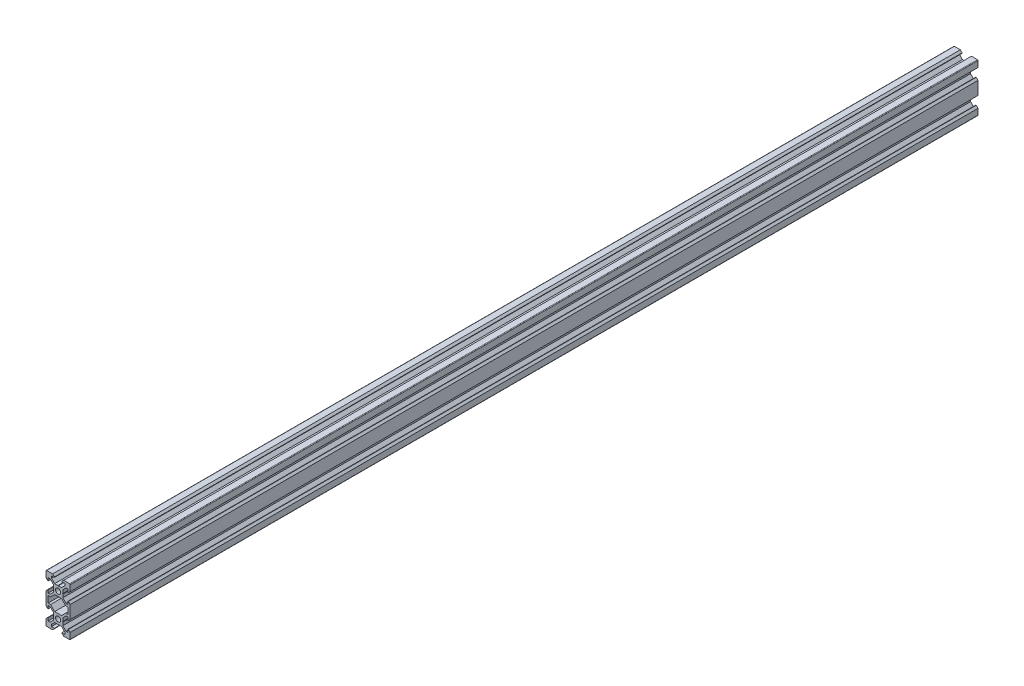
from build123d import *

# Parameters (mm, degrees)
SKETCH1_R           = 2.1
BOSS_EXTRUDE1_DEPTH = 750


with BuildPart() as part:
    # Sketch1 → Boss-Extrude1 (new body)
    with BuildSketch(Plane.XY):
        with BuildLine():
            Line((4.58, -20), (9.5, -20))
            ThreePointArc((9.5, -20), (9.853553391, -19.853553391), (10, -19.5))
            Line((10, -19.5), (10, -14.58))
            Line((10, -14.58), (8.545, -13.125))
            Line((8.545, -13.125), (8.2, -13.125))
            Line((8.2, -13.125), (8.2, -15.5))
            Line((8.2, -15.5), (6.560660172, -15.5))
            Line((6.560660172, -15.5), (3.9, -12.839339828))
            Line((3.9, -12.839339828), (3.9, -10.21))
            Line((3.9, -10.21), (3.69, -10))
            Line((3.69, -10), (3.9, -9.79))
            Line((3.9, -9.79), (3.9, -7.160660172))
            Line((3.9, -7.160660172), (6.560660172, -4.5))
            Line((6.560660172, -4.5), (8.2, -4.5))
            Line((8.2, -4.5), (8.2, -6.875))
            Line((8.2, -6.875), (8.545, -6.875))
            Line((8.545, -6.875), (10, -5.42))
            Line((10, -5.42), (10, 5.42))
            Line((10, 5.42), (8.545, 6.875))
            Line((8.545, 6.875), (8.2, 6.875))
            Line((8.2, 6.875), (8.2, 4.5))
            Line((8.2, 4.5), (6.560660172, 4.5))
            Line((6.560660172, 4.5), (3.9, 7.160660172))
            Line((3.9, 7.160660172), (3.9, 9.79))
            Line((3.9, 9.79), (3.69, 10))
            Line((3.69, 10), (3.9, 10.21))
            Line((3.9, 10.21), (3.9, 12.839339828))
            Line((3.9, 12.839339828), (6.560660172, 15.5))
            Line((6.560660172, 15.5), (8.2, 15.5))
            Line((8.2, 15.5), (8.2, 13.125))
            Line((8.2, 13.125), (8.545, 13.125))
            Line((8.545, 13.125), (10, 14.58))
            Line((10, 14.58), (10, 19.5))
            ThreePointArc((10, 19.5), (9.853553391, 19.853553391), (9.5, 20))
            Line((9.5, 20), (4.58, 20))
            Line((4.58, 20), (3.125, 18.545))
            Line((3.125, 18.545), (3.125, 18.2))
            Line((3.125, 18.2), (5.5, 18.2))
            Line((5.5, 18.2), (5.5, 16.560660172))
            Line((5.5, 16.560660172), (2.839339828, 13.9))
            Line((2.839339828, 13.9), (0.21, 13.9))
            Line((0.21, 13.9), (0, 13.69))
            Line((0, 13.69), (-0.21, 13.9))
            Line((-0.21, 13.9), (-2.839339828, 13.9))
            Line((-2.839339828, 13.9), (-5.5, 16.560660172))
            Line((-5.5, 16.560660172), (-5.5, 18.2))
            Line((-5.5, 18.2), (-3.125, 18.2))
            Line((-3.125, 18.2), (-3.125, 18.545))
            Line((-3.125, 18.545), (-4.58, 20))
            Line((-4.58, 20), (-9.5, 20))
            ThreePointArc((-9.5, 20), (-9.853553391, 19.853553391), (-10, 19.5))
            Line((-10, 19.5), (-10, 14.58))
            Line((-10, 14.58), (-8.545, 13.125))
            Line((-8.545, 13.125), (-8.2, 13.125))
            Line((-8.2, 13.125), (-8.2, 15.5))
            Line((-8.2, 15.5), (-6.560660172, 15.5))
            Line((-6.560660172, 15.5), (-3.9, 12.839339828))
            Line((-3.9, 12.839339828), (-3.9, 10.21))
            Line((-3.9, 10.21), (-3.69, 10))
            Line((-3.69, 10), (-3.9, 9.79))
            Line((-3.9, 9.79), (-3.9, 7.160660172))
            Line((-3.9, 7.160660172), (-6.560660172, 4.5))
            Line((-6.560660172, 4.5), (-8.2, 4.5))
            Line((-8.2, 4.5), (-8.2, 6.875))
            Line((-8.2, 6.875), (-8.545, 6.875))
            Line((-8.545, 6.875), (-10, 5.42))
            Line((-10, 5.42), (-10, -5.42))
            Line((-10, -5.42), (-8.545, -6.875))
            Line((-8.545, -6.875), (-8.2, -6.875))
            Line((-8.2, -6.875), (-8.2, -4.5))
            Line((-8.2, -4.5), (-6.560660172, -4.5))
            Line((-6.560660172, -4.5), (-3.9, -7.160660172))
            Line((-3.9, -7.160660172), (-3.9, -9.79))
            Line((-3.9, -9.79), (-3.69, -10))
            Line((-3.69, -10), (-3.9, -10.21))
            Line((-3.9, -10.21), (-3.9, -12.839339828))
            Line((-3.9, -12.839339828), (-6.560660172, -15.5))
            Line((-6.560660172, -15.5), (-8.2, -15.5))
            Line((-8.2, -15.5), (-8.2, -13.125))
            Line((-8.2, -13.125), (-8.545, -13.125))
            Line((-8.545, -13.125), (-10, -14.58))
            Line((-10, -14.58), (-10, -19.5))
            ThreePointArc((-10, -19.5), (-9.853553391, -19.853553391), (-9.5, -20))
            Line((-9.5, -20), (-4.58, -20))
            Line((-4.58, -20), (-3.125, -18.545))
            Line((-3.125, -18.545), (-3.125, -18.2))
            Line((-3.125, -18.2), (-5.5, -18.2))
            Line((-5.5, -18.2), (-5.5, -16.560660172))
            Line((-5.5, -16.560660172), (-2.839339828, -13.9))
            Line((-2.839339828, -13.9), (-0.21, -13.9))
            Line((-0.21, -13.9), (0, -13.69))
            Line((0, -13.69), (0.21, -13.9))
            Line((0.21, -13.9), (2.839339828, -13.9))
            Line((2.839339828, -13.9), (5.5, -16.560660172))
            Line((5.5, -16.560660172), (5.5, -18.2))
            Line((5.5, -18.2), (3.125, -18.2))
            Line((3.125, -18.2), (3.125, -18.545))
            Line((3.125, -18.545), (4.58, -20))
        make_face()
        with Locations((0, -10)):
            Circle(SKETCH1_R, mode=Mode.SUBTRACT)
        Polygon((-6.239339828, -2.7), (-8.2, -2.7), (-8.2, 2.7), (-6.239339828, 2.7), (-2.839339828, 6.1), (2.839339828, 6.1), (6.239339828, 2.7), (8.2, 2.7), (8.2, -2.7), (6.239339828, -2.7), (2.839339828, -6.1), (-2.839339828, -6.1), align=None, mode=Mode.SUBTRACT)
        with Locations((0, 10)):
            Circle(SKETCH1_R, mode=Mode.SUBTRACT)
    extrude(amount=BOSS_EXTRUDE1_DEPTH)


solid = part.part
